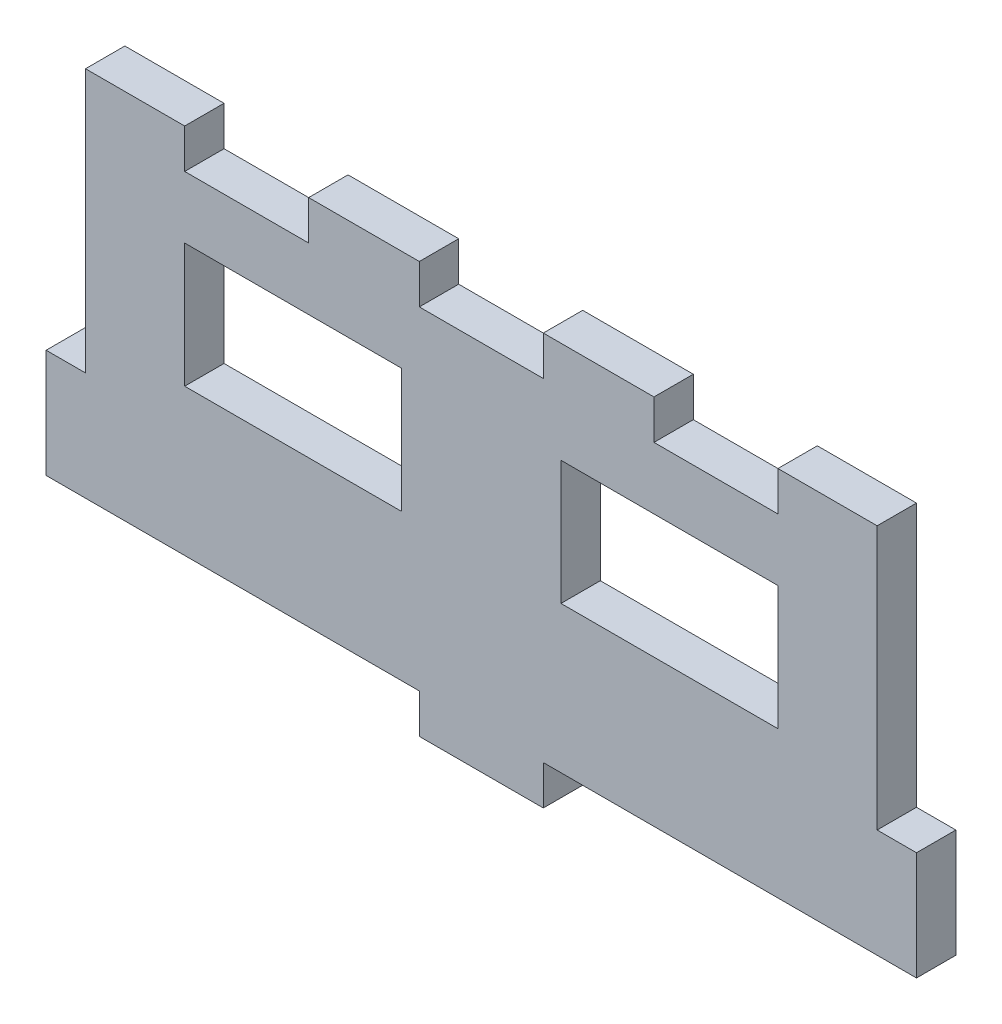
from build123d import *

# Parameters (mm, degrees)
SKETCH3_W           = 12.7
SKETCH3_H           = 35
SKETCH3_W_2         = 40
SKETCH3_H_2         = 12.7
BOSS_EXTRUDE1_DEPTH = 12.7
SKETCH4_W           = 40
SKETCH4_H           = 12.7
CUT_EXTRUDE1_DEPTH  = 12.7
SKETCH5_W           = 40
SKETCH5_H           = 12.7
SKETCH5_W_2         = 70
SKETCH5_H_2         = 40
CUT_EXTRUDE2_DEPTH  = 12.7


with BuildPart() as part:
    # Sketch3 → Boss-Extrude1 (new body)
    with BuildSketch(Plane.XY):
        Polygon((127.7, 60), (-127.7, 60), (-127.7, -25), (-127.7, -60), (-20, -60), (20, -60), (127.7, -60), (127.7, -25), align=None)
        with Locations((-134.05, -42.5)):
            Rectangle(SKETCH3_W, SKETCH3_H)
        with Locations((134.05, -42.5)):
            Rectangle(SKETCH3_W, SKETCH3_H)
        with Locations((0, -66.35)):
            Rectangle(SKETCH3_W_2, SKETCH3_H_2)
    extrude(amount=BOSS_EXTRUDE1_DEPTH)

    # Sketch4 → Cut-Extrude1 (cut)
    with BuildSketch(Plane.XY.offset(12.7)):
        with Locations((0, 53.65)):
            Rectangle(SKETCH4_W, SKETCH4_H)
    extrude(amount=-CUT_EXTRUDE1_DEPTH, mode=Mode.SUBTRACT)

    # Sketch5 → Cut-Extrude2 (cut)
    with BuildSketch(Plane.XY.offset(12.7)):
        with Locations((-75.7, 53.65)):
            Rectangle(SKETCH5_W, SKETCH5_H)
        with Locations((75.7, 53.65)):
            Rectangle(SKETCH5_W, SKETCH5_H)
        with Locations((-60.7, 7.3)):
            Rectangle(SKETCH5_W_2, SKETCH5_H_2)
        with Locations((60.7, 7.3)):
            Rectangle(SKETCH5_W_2, SKETCH5_H_2)
    extrude(amount=-CUT_EXTRUDE2_DEPTH, mode=Mode.SUBTRACT)


solid = part.part
